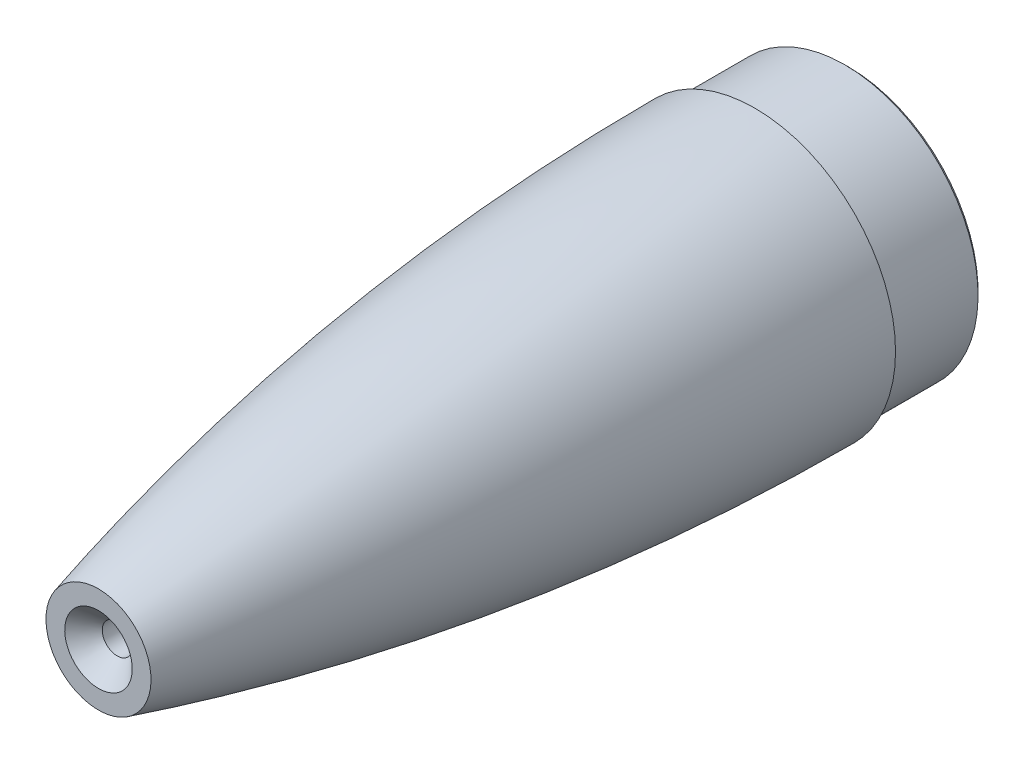
from build123d import *


with BuildPart() as part:
    # Sketch1 → Revolve1 (revolve)
    with BuildSketch(Plane(origin=(0, 0, 0), x_dir=(0, 0, -1), z_dir=(1, 0, 0))):
        with BuildLine():
            Line((-175, 14), (-175, 9))
            Line((-175, 9), (-170, 4))
            Line((-170, 4), (-120, 4))
            Line((-120, 4), (-120, 20))
            Line((-120, 20), (-60, 20))
            Line((-60, 20), (-60, 29.5))
            Line((-60, 29.5), (25, 29.5))
            Line((25, 29.5), (25, 34.5))
            Line((25, 34.5), (24, 35.5))
            Line((24, 35.5), (0, 35.5))
            Line((0, 35.5), (0, 37.5))
            ThreePointArc((0, 37.5), (-88.285403663, 31.598750684), (-175, 14))
        make_face()
    revolve(axis=Axis((0, 0, 0), (0, 0, 1)))


solid = part.part
